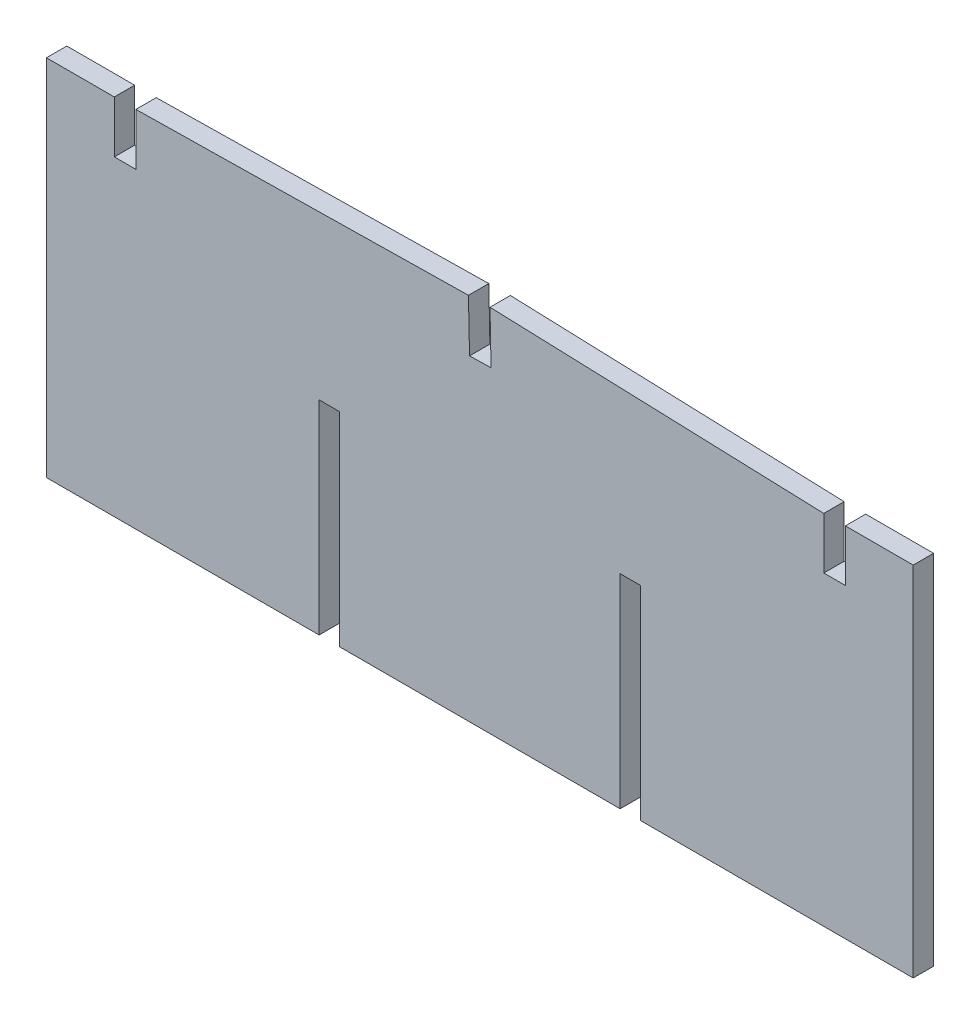
from build123d import *

# Parameters (mm, degrees)
BOSS_EXTRUDE1_DEPTH = 3


with BuildPart() as part:
    # Sketch2 → Boss-Extrude1 (new body)
    with BuildSketch(Plane.XY.offset(-353)):
        Polygon((371.221, 61.521478107), (374.396, 61.521478107), (374.396, 69.124950745), (384.396, 69.124950745), (384.396, 16.438825445), (344.221, 16.438825445), (344.221, 46.438825445), (341.221, 46.438825445), (341.221, 16.438825445), (299.875, 16.438825445), (299.875, 46.438825445), (296.875, 46.438825445), (296.875, 16.438825445), (256.7, 16.438825445), (256.7, 69.999273471), (266.7, 69.999273471), (266.7, 62.349211745), (269.875, 62.349211745), (269.875, 69.999275879), (318.872542602, 70.779885056), (319.031094476, 63.13005689), (322.205416715, 63.195722676), (322.046864787, 70.845553451), (371.221, 69.124947668), align=None)
    extrude(amount=-BOSS_EXTRUDE1_DEPTH)


solid = part.part
